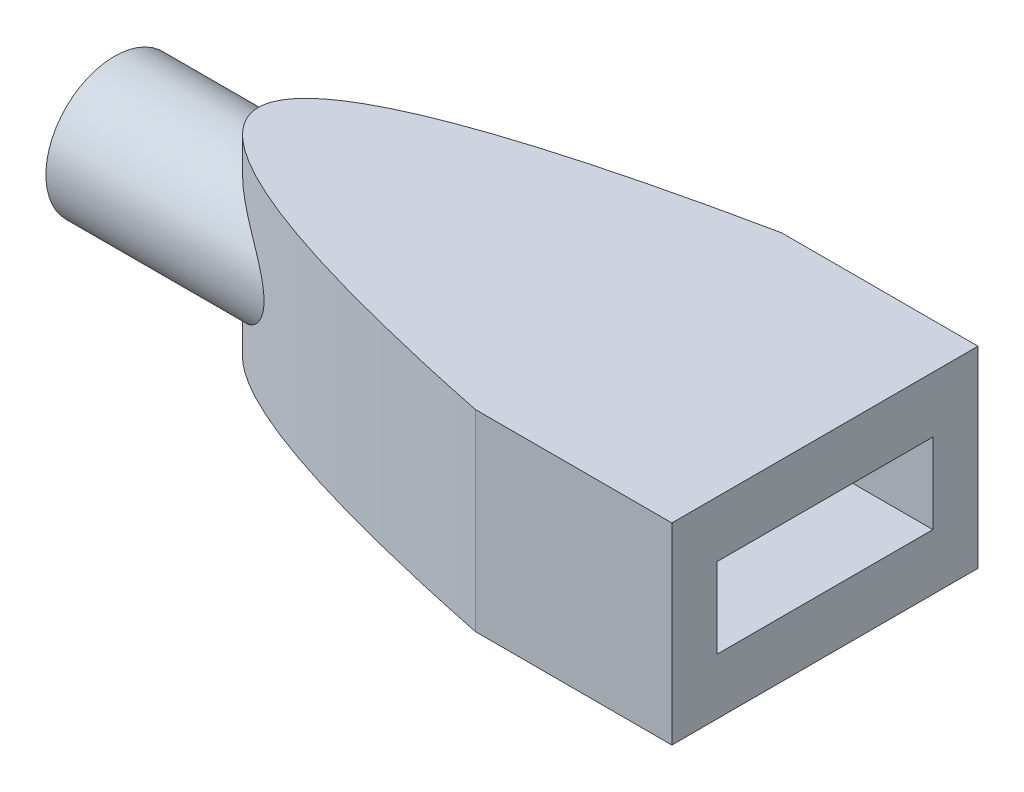
from build123d import *

# Parameters (mm, degrees)
SKETCH1_W                = 10.922
SKETCH1_H                = 17.018
BOSS_EXTRUDE1_DEPTH      = 5.3467
SKETCH2_W                = 12.0015
SKETCH2_H                = 4.4577
CUT_EXTRUDE1_DEPTH       = 9.7536
BOSS_EXTRUDE2_DEPTH      = 10.6934
BOSS_EXTRUDE3_DEPTH      = 9.7536
BOSS_EXTRUDE3_DEPTH_BACK = 8.001
SKETCH4_R                = 3.81


with BuildPart() as part:
    # Sketch1 → Boss-Extrude1 (new, symmetric)
    with BuildSketch(Plane(origin=(0, 0, 0), x_dir=(1, 0, 0), z_dir=(0, 1, 0))):
        Rectangle(SKETCH1_W, SKETCH1_H)
    extrude(amount=BOSS_EXTRUDE1_DEPTH, both=True)

    # Sketch2 → Cut-Extrude1 (cut)
    with BuildSketch(Plane(origin=(5.461, 0, 0), x_dir=(0, 0, -1), z_dir=(1, 0, 0))):
        Rectangle(SKETCH2_W, SKETCH2_H)
    extrude(amount=-CUT_EXTRUDE1_DEPTH, mode=Mode.SUBTRACT)

    # Sketch3 → Boss-Extrude2 (add)
    with BuildSketch(Plane(origin=(0, 5.3467, 0), x_dir=(1, 0, 0), z_dir=(0, 1, 0))):
        with BuildLine():
            Line((-5.461, 8.509), (-5.461, -8.509))
            add(Edge.make_bspline(
                [(-5.461, 8.509), (-46.609, 0), (-5.461, -8.509)],
                knots=[0, 0, 0, 1, 1, 1], degree=2))
        make_face()
    extrude(amount=-BOSS_EXTRUDE2_DEPTH)

    # Sketch4 → Boss-Extrude3 (add, two sides: drawn at the far end of the back side and taken through both)
    with BuildSketch(Plane(origin=(-26.035, 0, 0), x_dir=(0, 0, -1), z_dir=(1, 0, 0)).offset(-BOSS_EXTRUDE3_DEPTH_BACK)):
        Circle(SKETCH4_R)
    extrude(amount=BOSS_EXTRUDE3_DEPTH + BOSS_EXTRUDE3_DEPTH_BACK)


solid = part.part
